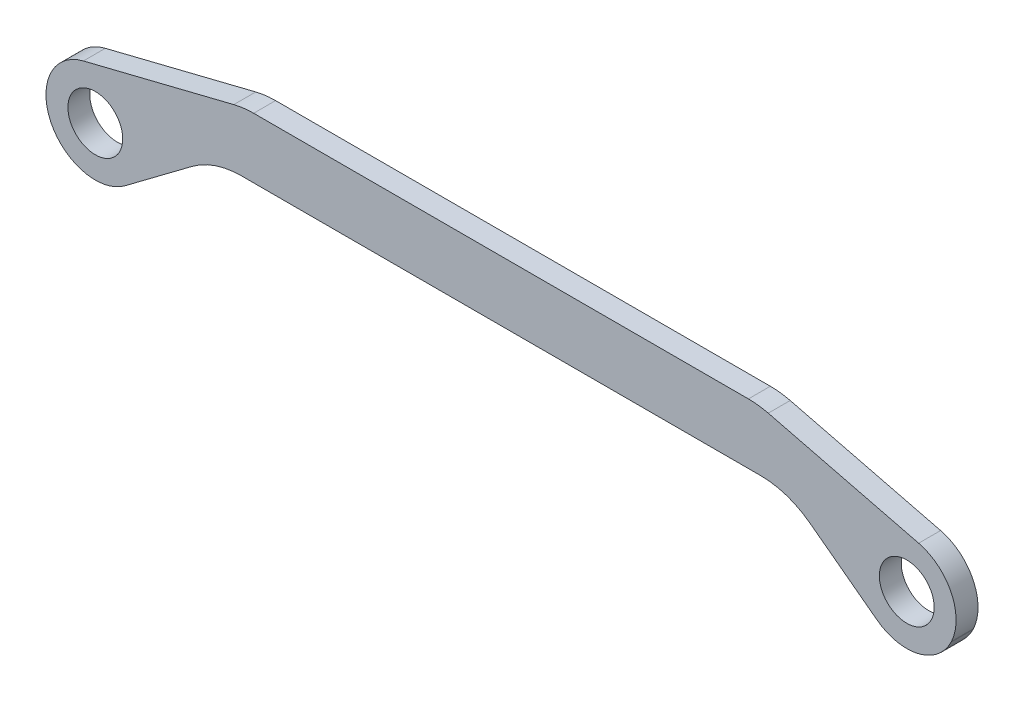
from build123d import *

# Parameters (mm, degrees)
SKETCH_1_R          = 4.4
EXTRUDE_1_DEPTH     = 4
SKETCH_2_R          = 5
CUT_EXTRUDE_1_DEPTH = 158.863865621


with BuildPart() as part:
    # 草图1 → 凸台-拉伸1 (new body)
    with BuildSketch(Plane.XY):
        with BuildLine():
            Line((28.880385739, 16.000002151), (119.119616625, 16.000002151))
            ThreePointArc((119.119616625, 16.000002151), (120.9433115, 15.888727315), (122.739948861, 15.556553752))
            Line((122.739948861, 15.556553752), (150.172338317, 8.733896395))
            ThreePointArc((150.172338317, 8.733896395), (156.114779707, 3.892345091), (156.171177789, -3.772512896))
            Line((156.171177789, -3.772512896), (156.085333125, -3.953149157))
            ThreePointArc((156.085333125, -3.953149157), (150.10671868, -8.749956366), (142.6, -7.2))
            Line((142.6, -7.2), (130.332298736, 2.00024794))
            ThreePointArc((130.332298736, 2.00024794), (126.075849791, 4.230314828), (121.332629297, 5.000000026))
            Line((121.332629297, 5.000000026), (26.667370753, 5.000000026))
            ThreePointArc((26.667370753, 5.000000026), (21.92415066, 4.230315582), (17.667701778, 2.000249685))
            Line((17.667701778, 2.000249685), (5.400000428, -7.199998281))
            ThreePointArc((5.400000428, -7.199998281), (-2.106718252, -8.749954647), (-8.085332697, -3.953147439))
            Line((-8.085332697, -3.953147439), (-8.171177361, -3.772511177))
            ThreePointArc((-8.171177361, -3.772511177), (-8.114780484, 3.892344299), (-2.172343294, 8.73389677))
            Line((-2.172343294, 8.73389677), (25.260054408, 15.556553977))
            ThreePointArc((25.260054408, 15.556553977), (27.056691327, 15.888727372), (28.880385739, 16.000002151))
        make_face()
        with Locations((4.28e-07, 1.719e-06)):
            Circle(SKETCH_1_R, mode=Mode.SUBTRACT)
        with Locations((148, 0)):
            Circle(SKETCH_1_R, mode=Mode.SUBTRACT)
    extrude(amount=EXTRUDE_1_DEPTH)

    # 草图2 → 切除-拉伸1 (cut, through all)
    with BuildSketch(Plane.XY.offset(4)):
        Circle(SKETCH_2_R)
        with Locations((148, 0)):
            Circle(SKETCH_2_R)
    extrude(amount=-CUT_EXTRUDE_1_DEPTH, mode=Mode.SUBTRACT)


solid = part.part
